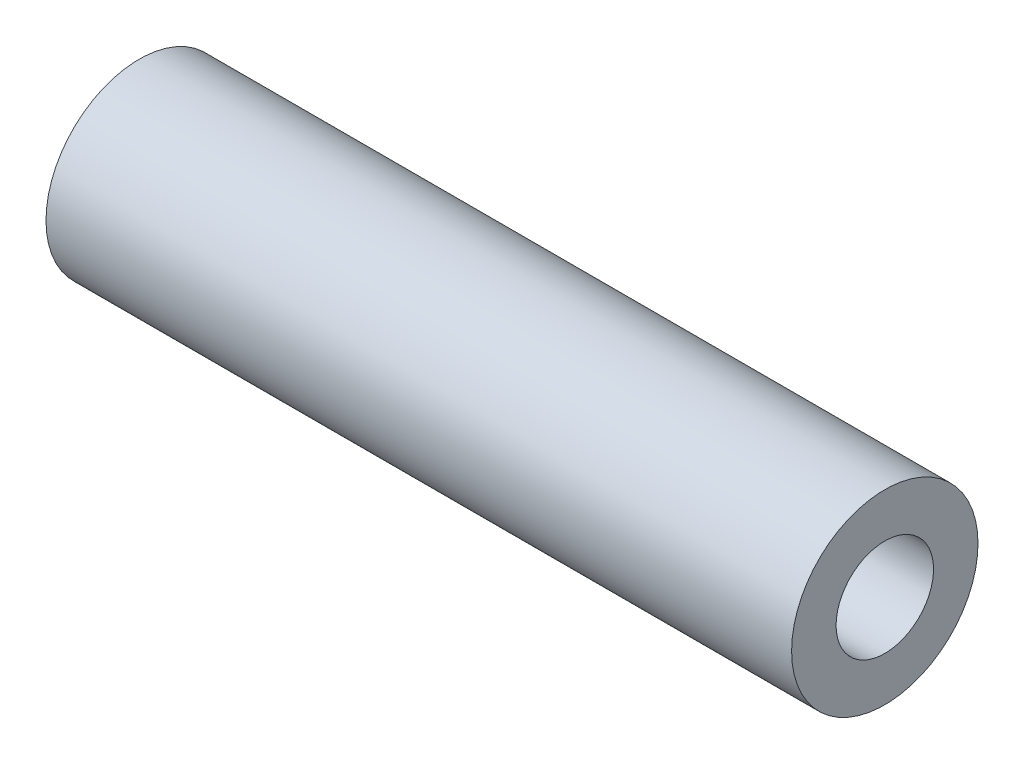
from build123d import *

# Parameters (mm, degrees)
SKETCH1_R           = 4.7625
SKETCH1_R_2         = 2.4892
BOSS_EXTRUDE1_DEPTH = 19.05


with BuildPart() as part:
    # Sketch1 → Boss-Extrude1 (new, symmetric)
    with BuildSketch(Plane(origin=(0, 0, 0), x_dir=(0, 0, -1), z_dir=(1, 0, 0))):
        with Locations(Location((0, 0, 0), (0, 0, 180))):
            Circle(SKETCH1_R)
        with Locations(Location((0, 0, 0), (0, 0, 180))):
            Circle(SKETCH1_R_2, mode=Mode.SUBTRACT)
    extrude(amount=BOSS_EXTRUDE1_DEPTH, both=True)


solid = part.part
